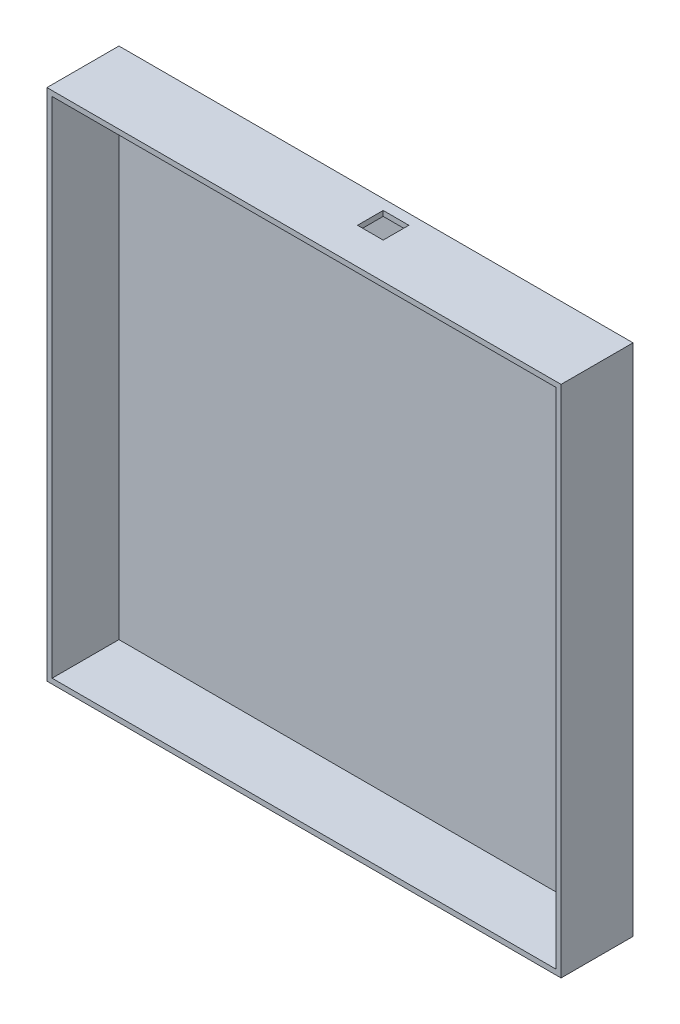
from build123d import *

# Parameters (mm, degrees)
SKETCH1_W           = 100
SKETCH1_H           = 100
SKETCH1_W_2         = 98
SKETCH1_H_2         = 98
BOSS_EXTRUDE1_DEPTH = 13
SKETCH2_W           = 100
SKETCH2_H           = 100
BOSS_EXTRUDE2_DEPTH = 1
SKETCH3_W           = 5
SKETCH3_H           = 5
CUT_EXTRUDE1_DEPTH  = 2


with BuildPart() as part:
    # Sketch1 → Boss-Extrude1 (new body)
    with BuildSketch(Plane.XY):
        Rectangle(SKETCH1_W, SKETCH1_H)
        Rectangle(SKETCH1_W_2, SKETCH1_H_2, mode=Mode.SUBTRACT)
    extrude(amount=BOSS_EXTRUDE1_DEPTH)

    # Sketch2 → Boss-Extrude2 (add)
    with BuildSketch(Plane(origin=(0, 0, 0), x_dir=(-1, 0, 0), z_dir=(0, 0, -1))):
        Rectangle(SKETCH2_W, SKETCH2_H)
    extrude(amount=BOSS_EXTRUDE2_DEPTH)

    # Sketch3 → Cut-Extrude1 (cut)
    with BuildSketch(Plane(origin=(0, 50, 0), x_dir=(1, 0, 0), z_dir=(0, 1, 0))):
        with Locations((5.9, -3.5)):
            Rectangle(SKETCH3_W, SKETCH3_H)
    extrude(amount=-CUT_EXTRUDE1_DEPTH, mode=Mode.SUBTRACT)


solid = part.part
